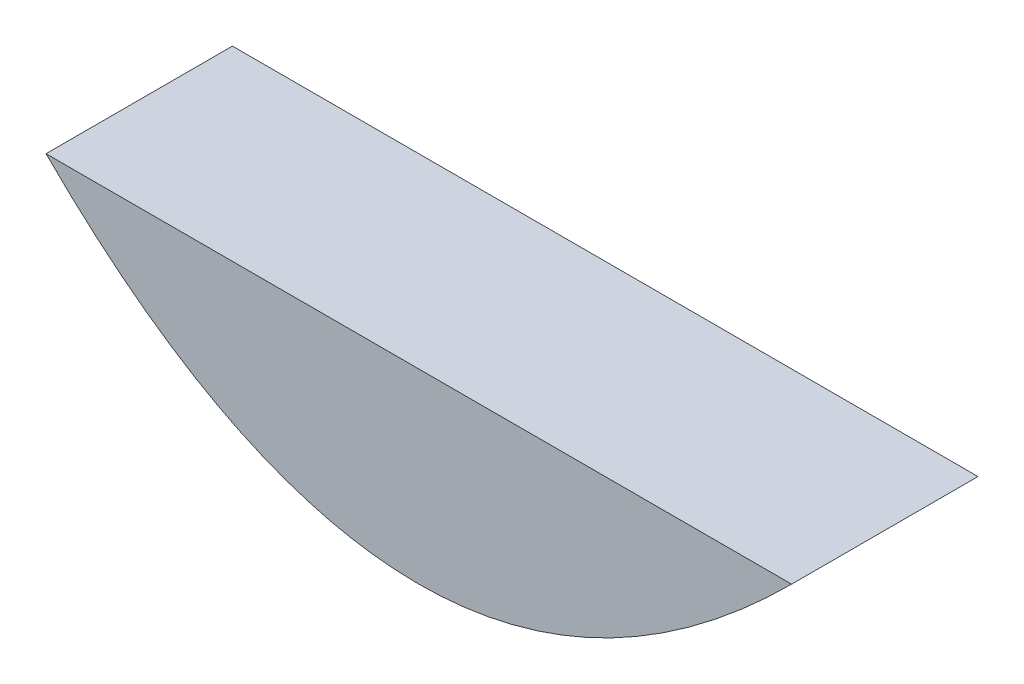
from build123d import *

# Parameters (mm, degrees)
BOSS_EXTRUDE1_DEPTH = 5


with BuildPart() as part:
    # Sketch1 → Boss-Extrude1 (new body)
    with BuildSketch(Plane.XY):
        with BuildLine():
            Line((5, 10), (25, 10))
            add(Edge.make_bspline(
                [(5, 10), (15, 0), (25, 10)],
                knots=[0, 0, 0, 1, 1, 1], degree=2))
        make_face()
    extrude(amount=BOSS_EXTRUDE1_DEPTH)


solid = part.part
